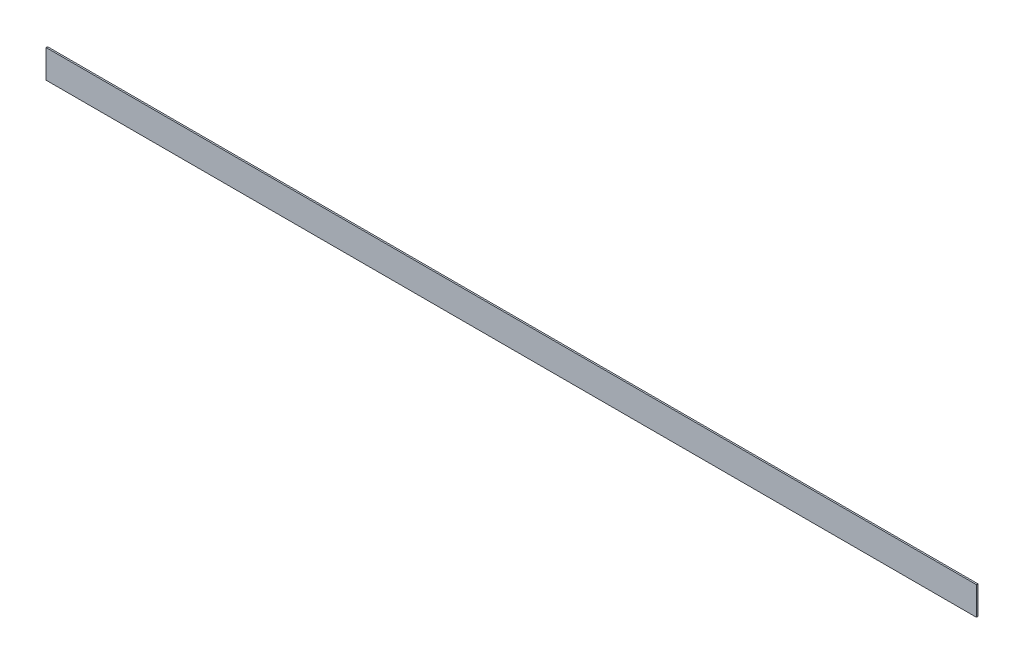
from build123d import *

# Parameters (mm, degrees)
SKETCH1_W           = 15840.931821118
SKETCH1_H           = 481.496334187
BOSS_EXTRUDE1_DEPTH = 25.4


with BuildPart() as part:
    # Sketch1 → Boss-Extrude1 (new body)
    with BuildSketch(Plane.XY):
        with Locations((6601.734936223, 240.748167094)):
            Rectangle(SKETCH1_W, SKETCH1_H)
    extrude(amount=BOSS_EXTRUDE1_DEPTH)


solid = part.part
